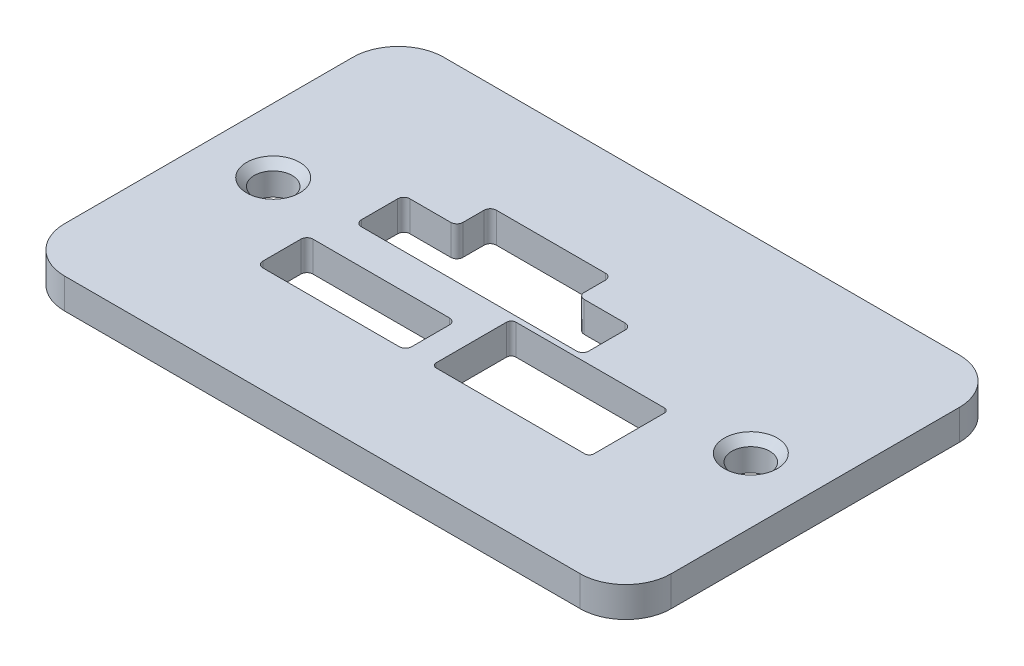
from build123d import *

# Parameters (mm, degrees)
EXTRUDE_1_DEPTH            = 2
CUT_EXTRUDE_1_REACH        = 25.67
SKETCH_2_R                 = 1.25
CHAMFER_1_SIZE             = 0.5
CHAMFER_1_OF_MIRROR_3_SIZE = 0.5
CUT_EXTRUDE_5_REACH        = 25.67


with BuildPart() as part:
    # 草图1 → 凸台-拉伸1 (new body)
    with BuildSketch(Plane(origin=(0, 0, 0), x_dir=(1, 0, 0), z_dir=(0, 1, 0))):
        with BuildLine():
            Line((-17, 12.5), (17, 12.5))
            ThreePointArc((17, 12.5), (19.121320344, 11.621320344), (20, 9.5))
            Line((20, 9.5), (20, -9.5))
            ThreePointArc((20, -9.5), (19.121320344, -11.621320344), (17, -12.5))
            Line((17, -12.5), (-17, -12.5))
            ThreePointArc((-17, -12.5), (-19.121320344, -11.621320344), (-20, -9.5))
            Line((-20, -9.5), (-20, 9.5))
            ThreePointArc((-20, 9.5), (-19.121320344, 11.621320344), (-17, 12.5))
        make_face()
    extrude(amount=EXTRUDE_1_DEPTH)

    # 草图2 → 切除-拉伸1 (cut, up to next)
    with BuildSketch(Plane(origin=(0, 2, 0), x_dir=(1, 0, 0), z_dir=(0, 1, 0)), mode=Mode.PRIVATE) as cut_extrude_1_sk1:
        with Locations(Location((-15.75, 0, 0), (0, 0, 270))):
            Circle(SKETCH_2_R)
    cut_extrude_1_tool1 = extrude(cut_extrude_1_sk1.sketch, amount=-CUT_EXTRUDE_1_REACH, mode=Mode.PRIVATE) & part.part
    cut_extrude_1 = cut_extrude_1_tool1.solids().sort_by_distance((-15.75, 2, 0))[0]
    add(cut_extrude_1, mode=Mode.SUBTRACT)

    # 倒角1
    chamfer_1_edges = [part.edges().sort_by_distance(p)[0] for p in [
        (-15.75, 2, -1.25),
    ]]
    chamfer(chamfer_1_edges, length=CHAMFER_1_SIZE)

    # 镜向3: 切除-拉伸1 across plane
    add(cut_extrude_1.mirror(Plane(origin=(0, 0, 0), x_dir=(0, 0, 1), z_dir=(1, 0, 0))), mode=Mode.SUBTRACT)

    # 倒角1 of 镜向3
    chamfer_1_of_mirror_3_edges = [part.edges().sort_by_distance(p)[0] for p in [
        (15.75, 2, -1.25),
    ]]
    chamfer(chamfer_1_of_mirror_3_edges, length=CHAMFER_1_OF_MIRROR_3_SIZE)

    # 草图6 → 切除-拉伸5 (cut, up to next)
    with BuildSketch(Plane(origin=(0, 2, 0), x_dir=(1, 0, 0), z_dir=(0, 1, 0)), mode=Mode.PRIVATE) as cut_extrude_5_sk1:
        with BuildLine():
            Line((-10.036, 3.3), (-7.336, 3.3))
            ThreePointArc((-7.336, 3.3), (-7.053157288, 3.417157288), (-6.936, 3.7))
            Line((-6.936, 3.7), (-6.936, 5.1))
            ThreePointArc((-6.936, 5.1), (-6.818842712, 5.382842712), (-6.536, 5.5))
            Line((-6.536, 5.5), (0.664, 5.5))
            ThreePointArc((0.664, 5.5), (0.946842712, 5.382842712), (1.064, 5.1))
            Line((1.064, 5.1), (1.064, 3.7))
            ThreePointArc((1.064, 3.7), (1.181157288, 3.417157288), (1.464, 3.3))
            Line((1.464, 3.3), (4.164, 3.3))
            ThreePointArc((4.164, 3.3), (4.446842712, 3.182842712), (4.564, 2.9))
            Line((4.564, 2.9), (4.564, 0.5))
            ThreePointArc((4.564, 0.5), (4.446842712, 0.217157288), (4.164, 0.1))
            Line((4.164, 0.1), (-10.036, 0.1))
            ThreePointArc((-10.036, 0.1), (-10.318842712, 0.217157288), (-10.436, 0.5))
            Line((-10.436, 0.5), (-10.436, 2.9))
            ThreePointArc((-10.436, 2.9), (-10.318842712, 3.182842712), (-10.036, 3.3))
        make_face()
    cut_extrude_5_tool1 = extrude(cut_extrude_5_sk1.sketch, amount=-CUT_EXTRUDE_5_REACH, mode=Mode.PRIVATE) & part.part
    # 草图6 → 切除-拉伸5 (cut, up to next)
    with BuildSketch(Plane(origin=(0, 2, 0), x_dir=(1, 0, 0), z_dir=(0, 1, 0)), mode=Mode.PRIVATE) as cut_extrude_5_sk2:
        with BuildLine():
            Line((-10.925, -2.2), (-1.925, -2.2))
            ThreePointArc((-1.925, -2.2), (-1.642157288, -2.317157288), (-1.525, -2.6))
            Line((-1.525, -2.6), (-1.525, -5.1))
            ThreePointArc((-1.525, -5.1), (-1.642157288, -5.382842712), (-1.925, -5.5))
            Line((-1.925, -5.5), (-10.925, -5.5))
            ThreePointArc((-10.925, -5.5), (-11.207842712, -5.382842712), (-11.325, -5.1))
            Line((-11.325, -5.1), (-11.325, -2.6))
            ThreePointArc((-11.325, -2.6), (-11.207842712, -2.317157288), (-10.925, -2.2))
        make_face()
    cut_extrude_5_tool2 = extrude(cut_extrude_5_sk2.sketch, amount=-CUT_EXTRUDE_5_REACH, mode=Mode.PRIVATE) & part.part
    # 草图6 → 切除-拉伸5 (cut, up to next)
    with BuildSketch(Plane(origin=(0, 2, 0), x_dir=(1, 0, 0), z_dir=(0, 1, 0)), mode=Mode.PRIVATE) as cut_extrude_5_sk3:
        with BuildLine():
            Line((0.5, -0.25), (10.3, -0.25))
            ThreePointArc((10.3, -0.25), (10.512132034, -0.337867966), (10.6, -0.55))
            Line((10.6, -0.55), (10.6, -5.2))
            ThreePointArc((10.6, -5.2), (10.512132034, -5.412132034), (10.3, -5.5))
            Line((10.3, -5.5), (0.5, -5.5))
            ThreePointArc((0.5, -5.5), (0.287867966, -5.412132034), (0.2, -5.2))
            Line((0.2, -5.2), (0.2, -0.55))
            ThreePointArc((0.2, -0.55), (0.287867966, -0.337867966), (0.5, -0.25))
        make_face()
    cut_extrude_5_tool3 = extrude(cut_extrude_5_sk3.sketch, amount=-CUT_EXTRUDE_5_REACH, mode=Mode.PRIVATE) & part.part
    add(cut_extrude_5_tool1.solids().sort_by_distance((-2.936, 2, -2.42379))[0], mode=Mode.SUBTRACT)
    add(cut_extrude_5_tool2.solids().sort_by_distance((-6.425, 2, 3.85))[0], mode=Mode.SUBTRACT)
    add(cut_extrude_5_tool3.solids().sort_by_distance((5.4, 2, 2.875))[0], mode=Mode.SUBTRACT)


solid = part.part
